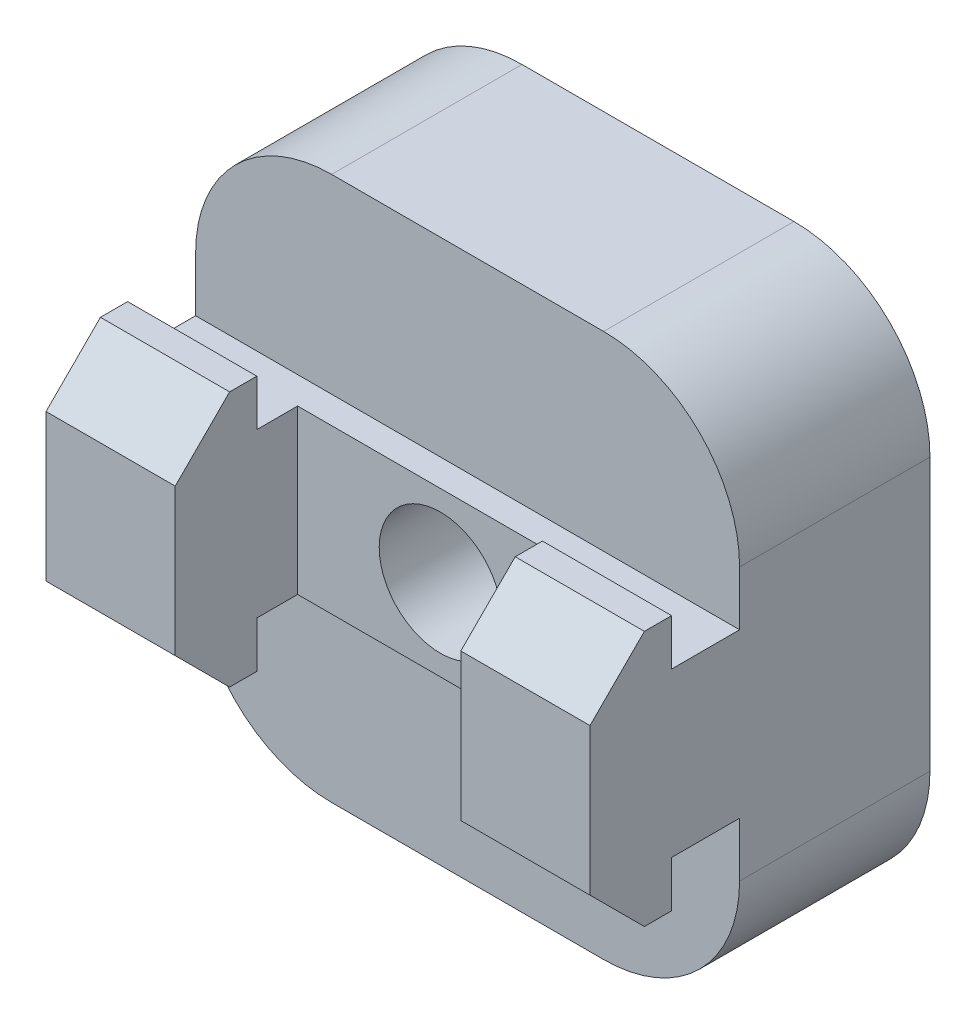
from build123d import *

# Parameters (mm, degrees)
BOSS_EXTRUDE1_DEPTH = 10
SKETCH3_R           = 2.25
CUT_EXTRUDE1_DEPTH  = 19.874586088
SKETCH4_W           = 9
SKETCH4_H           = 17.100076188
CUT_EXTRUDE2_DEPTH  = 5.25
FILLET1_R           = 5


with BuildPart() as part:
    # Sketch1 → Boss-Extrude1 (new, symmetric)
    with BuildSketch(Plane(origin=(0, 0, 0), x_dir=(0, 0, -1), z_dir=(1, 0, 0))):
        Polygon((-9.5, 3), (-9.5, 4.7), (-10.5, 4.7), (-12.5, 2.7), (-12.5, -2.7), (-10.5, -4.7), (-9.5, -4.7), (-9.5, -3), (-7, -3), (-7, -10), (0, -10), (0, 10), (-7, 10), (-7, 3), align=None)
    extrude(amount=BOSS_EXTRUDE1_DEPTH, both=True)

    # Sketch3 → Cut-Extrude1 (cut, through all)
    with BuildSketch(Plane(origin=(0, 0, 0), x_dir=(-1, 0, 0), z_dir=(0, 0, -1))):
        Circle(SKETCH3_R)
    extrude(amount=-CUT_EXTRUDE1_DEPTH, mode=Mode.SUBTRACT)

    # Sketch4 → Cut-Extrude2 (cut, symmetric)
    with BuildSketch(Plane(origin=(0, 0, 0), x_dir=(0, 0, -1), z_dir=(1, 0, 0))):
        with Locations((-12.5, 0)):
            Rectangle(SKETCH4_W, SKETCH4_H)
    extrude(amount=CUT_EXTRUDE2_DEPTH, both=True, mode=Mode.SUBTRACT)

    # Fillet1
    fillet1_edges = [part.edges().sort_by_distance(p)[0] for p in [
        (10, -10, 3.5),
        (-10, 10, 3.5),
        (-10, -10, 3.5),
        (10, 10, 3.5),
    ]]
    fillet(fillet1_edges, radius=FILLET1_R)


solid = part.part
